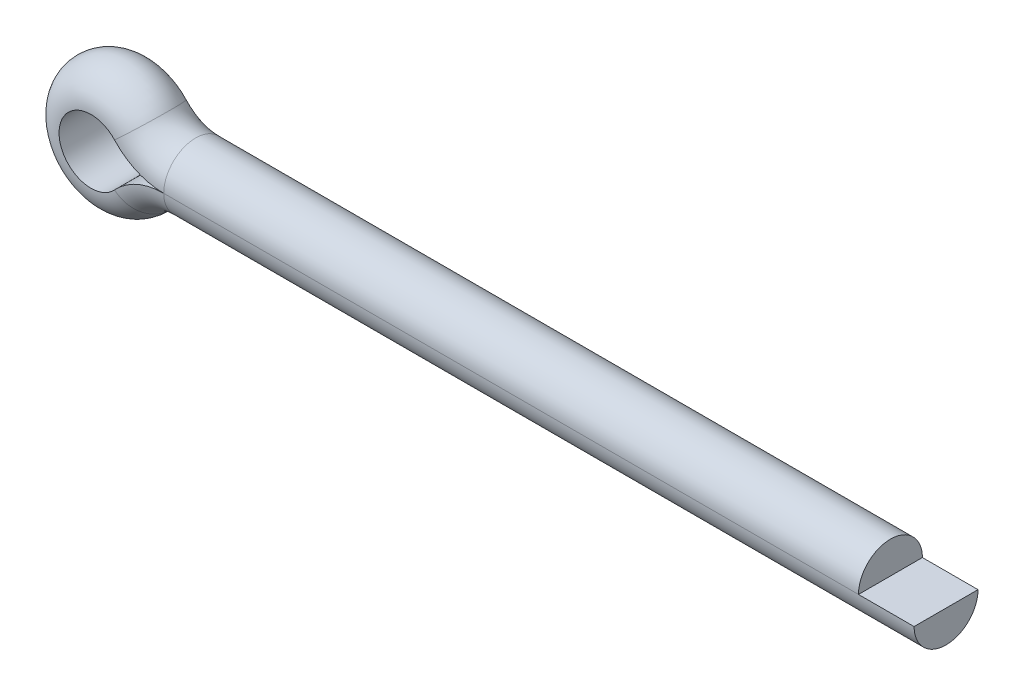
from build123d import *


with BuildPart() as part:
    # 扫描1: sweep along a path in 草图1
    with BuildLine(Plane.XY) as sweep_1_path:
        Line((0, 2.3), (-50, 2.3))
        ThreePointArc((-50, 2.3), (-51.006143103, 2.511403038), (-51.842124839, 3.109859155))
        ThreePointArc((-51.842124839, 3.109859155), (-59.831634544, 0), (-51.842124839, -3.109859155))
        ThreePointArc((-51.842124839, -3.109859155), (-51.006143103, -2.511403038), (-50, -2.3))
        Line((-50, -2.3), (4, -2.3))
    # 草图2 → 扫描1 (sweep)
    with BuildSketch(Plane(origin=(0, 0, 0), x_dir=(0, 0, -1), z_dir=(1, 0, 0))):
        with BuildLine():
            Line((-2.3, 0), (2.3, 0))
            ThreePointArc((2.3, 0), (0, 2.3), (-2.3, 0))
        make_face()
    sweep(path=sweep_1_path.line)


solid = part.part
